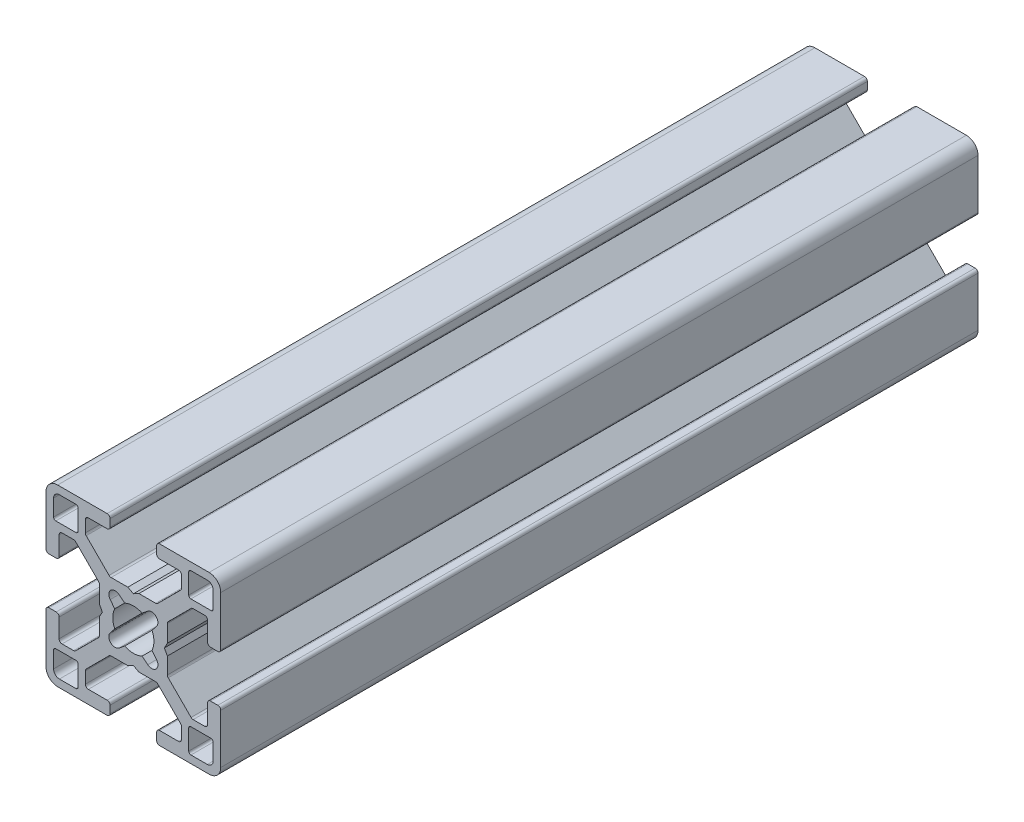
from build123d import *

# Parameters (mm, degrees)
EXTRUDE1_DEPTH = 130


with BuildPart() as part:
    # Sketch1 → Extrude1 (new body)
    with BuildSketch(Plane.XY):
        with BuildLine():
            Line((12.74247465, -4.5), (12.74247465, -7.732519321))
            ThreePointArc((12.74247465, -7.732519321), (12.602449697, -8.097296796), (12.242781236, -8.249967))
            Line((12.242781236, -8.249967), (10.260188032, -8.249967))
            ThreePointArc((10.260188032, -8.249967), (10.068847082, -8.211906919), (9.906636056, -8.103520976))
            Line((9.906636056, -8.103520976), (5.981117769, -4.178002689))
            ThreePointArc((5.981117769, -4.178002689), (5.872731827, -4.015791664), (5.834671745, -3.824450713))
            Line((5.834671745, -3.824450713), (5.834671745, -1.01249595))
            Line((5.834671745, -1.01249595), (5.324673785, -0.06249975))
            Line((5.324673785, -0.06249975), (5.834671745, 0.88749645))
            Line((5.834671745, 0.88749645), (5.834671745, 3.824450713))
            ThreePointArc((5.834671745, 3.824450713), (5.872731827, 4.015791664), (5.981117769, 4.178002689))
            Line((5.981117769, 4.178002689), (9.906636056, 8.103520976))
            ThreePointArc((9.906636056, 8.103520976), (10.068847082, 8.211906919), (10.260188032, 8.249967))
            Line((10.260188032, 8.249967), (12.242781236, 8.249967))
            ThreePointArc((12.242781236, 8.249967), (12.602449697, 8.097296796), (12.74247465, 7.732519321))
            Line((12.74247465, 7.732519321), (12.74247465, 4.5))
            ThreePointArc((12.74247465, 4.5), (12.88892126, 4.146446609), (13.24247465, 4))
            Line((13.24247465, 4), (14.49994, 4))
            ThreePointArc((14.49994, 4), (14.853493391, 4.146446609), (14.99994, 4.5))
            Line((14.99994, 4.5), (14.99994, 12.999948))
            ThreePointArc((14.99994, 12.999948), (14.414155906, 14.414155906), (12.999948, 14.99994))
            Line((12.999948, 14.99994), (4.5, 14.99994))
            ThreePointArc((4.5, 14.99994), (4.146446609, 14.853493391), (4, 14.49994))
            Line((4, 14.49994), (4, 13.24247465))
            ThreePointArc((4, 13.24247465), (4.146446609, 12.88892126), (4.5, 12.74247465))
            Line((4.5, 12.74247465), (7.732519321, 12.74247465))
            ThreePointArc((7.732519321, 12.74247465), (8.097296796, 12.602449697), (8.249967, 12.242781236))
            Line((8.249967, 12.242781236), (8.249967, 10.260188032))
            ThreePointArc((8.249967, 10.260188032), (8.211906919, 10.068847082), (8.103520976, 9.906636056))
            Line((8.103520976, 9.906636056), (4.178002689, 5.981117769))
            ThreePointArc((4.178002689, 5.981117769), (4.015791664, 5.872731827), (3.824450713, 5.834671745))
            Line((3.824450713, 5.834671745), (0.9499962, 5.834671745))
            Line((0.9499962, 5.834671745), (0, 5.324673785))
            Line((0, 5.324673785), (-0.9499962, 5.834671745))
            Line((-0.9499962, 5.834671745), (-3.824450713, 5.834671745))
            ThreePointArc((-3.824450713, 5.834671745), (-4.015791664, 5.872731827), (-4.178002689, 5.981117769))
            Line((-4.178002689, 5.981117769), (-8.103520976, 9.906636056))
            ThreePointArc((-8.103520976, 9.906636056), (-8.211906919, 10.068847082), (-8.249967, 10.260188032))
            Line((-8.249967, 10.260188032), (-8.249967, 12.242781236))
            ThreePointArc((-8.249967, 12.242781236), (-8.097296796, 12.602449697), (-7.732519321, 12.74247465))
            Line((-7.732519321, 12.74247465), (-4.5, 12.74247465))
            ThreePointArc((-4.5, 12.74247465), (-4.146446609, 12.88892126), (-4, 13.24247465))
            Line((-4, 13.24247465), (-4, 14.49994))
            ThreePointArc((-4, 14.49994), (-4.146446609, 14.853493391), (-4.5, 14.99994))
            Line((-4.5, 14.99994), (-12.999948, 14.99994))
            ThreePointArc((-12.999948, 14.99994), (-14.414155906, 14.414155906), (-14.99994, 12.999948))
            Line((-14.99994, 12.999948), (-14.99994, 4.5))
            ThreePointArc((-14.99994, 4.5), (-14.853493391, 4.146446609), (-14.49994, 4))
            Line((-14.49994, 4), (-13.24247465, 4))
            ThreePointArc((-13.24247465, 4), (-12.88892126, 4.146446609), (-12.74247465, 4.5))
            Line((-12.74247465, 4.5), (-12.74247465, 7.732519321))
            ThreePointArc((-12.74247465, 7.732519321), (-12.602449697, 8.097296796), (-12.242781236, 8.249967))
            Line((-12.242781236, 8.249967), (-10.260188032, 8.249967))
            ThreePointArc((-10.260188032, 8.249967), (-10.068847082, 8.211906919), (-9.906636056, 8.103520976))
            Line((-9.906636056, 8.103520976), (-5.981117769, 4.178002689))
            ThreePointArc((-5.981117769, 4.178002689), (-5.872731827, 4.015791664), (-5.834671745, 3.824450713))
            Line((-5.834671745, 3.824450713), (-5.834671745, 0.88749645))
            Line((-5.834671745, 0.88749645), (-5.324673785, -0.06249975))
            Line((-5.324673785, -0.06249975), (-5.834671745, -1.01249595))
            Line((-5.834671745, -1.01249595), (-5.834671745, -3.824450713))
            ThreePointArc((-5.834671745, -3.824450713), (-5.872731827, -4.015791664), (-5.981117769, -4.178002689))
            Line((-5.981117769, -4.178002689), (-9.906636056, -8.103520976))
            ThreePointArc((-9.906636056, -8.103520976), (-10.068847082, -8.211906919), (-10.260188032, -8.249967))
            Line((-10.260188032, -8.249967), (-12.242781236, -8.249967))
            ThreePointArc((-12.242781236, -8.249967), (-12.602449697, -8.097296796), (-12.74247465, -7.732519321))
            Line((-12.74247465, -7.732519321), (-12.74247465, -4.5))
            ThreePointArc((-12.74247465, -4.5), (-12.88892126, -4.146446609), (-13.24247465, -4))
            Line((-13.24247465, -4), (-14.49994, -4))
            ThreePointArc((-14.49994, -4), (-14.853493391, -4.146446609), (-14.99994, -4.5))
            Line((-14.99994, -4.5), (-14.99994, -12.999948))
            ThreePointArc((-14.99994, -12.999948), (-14.414155906, -14.414155906), (-12.999948, -14.99994))
            Line((-12.999948, -14.99994), (-4.5, -14.99994))
            ThreePointArc((-4.5, -14.99994), (-4.146446609, -14.853493391), (-4, -14.49994))
            Line((-4, -14.49994), (-4, -13.24247465))
            ThreePointArc((-4, -13.24247465), (-4.146446609, -12.88892126), (-4.5, -12.74247465))
            Line((-4.5, -12.74247465), (-7.732519321, -12.74247465))
            ThreePointArc((-7.732519321, -12.74247465), (-8.097296796, -12.602449697), (-8.249967, -12.242781236))
            Line((-8.249967, -12.242781236), (-8.249967, -10.260188032))
            ThreePointArc((-8.249967, -10.260188032), (-8.211906919, -10.068847082), (-8.103520976, -9.906636056))
            Line((-8.103520976, -9.906636056), (-4.178002689, -5.981117769))
            ThreePointArc((-4.178002689, -5.981117769), (-4.015791664, -5.872731827), (-3.824450713, -5.834671745))
            Line((-3.824450713, -5.834671745), (-0.9499962, -5.834671745))
            Line((-0.9499962, -5.834671745), (0, -5.324673785))
            Line((0, -5.324673785), (0.9499962, -5.834671745))
            Line((0.9499962, -5.834671745), (3.824450713, -5.834671745))
            ThreePointArc((3.824450713, -5.834671745), (4.015791664, -5.872731827), (4.178002689, -5.981117769))
            Line((4.178002689, -5.981117769), (8.103520976, -9.906636056))
            ThreePointArc((8.103520976, -9.906636056), (8.211906919, -10.068847082), (8.249967, -10.260188032))
            Line((8.249967, -10.260188032), (8.249967, -12.242781236))
            ThreePointArc((8.249967, -12.242781236), (8.097296796, -12.602449697), (7.732519321, -12.74247465))
            Line((7.732519321, -12.74247465), (4.5, -12.74247465))
            ThreePointArc((4.5, -12.74247465), (4.146446609, -12.88892126), (4, -13.24247465))
            Line((4, -13.24247465), (4, -14.49994))
            ThreePointArc((4, -14.49994), (4.146446609, -14.853493391), (4.5, -14.99994))
            Line((4.5, -14.99994), (12.999948, -14.99994))
            ThreePointArc((12.999948, -14.99994), (14.414155906, -14.414155906), (14.99994, -12.999948))
            Line((14.99994, -12.999948), (14.99994, -4.5))
            ThreePointArc((14.99994, -4.5), (14.853493391, -4.146446609), (14.49994, -4))
            Line((14.49994, -4), (13.24247465, -4))
            ThreePointArc((13.24247465, -4), (12.88892126, -4.146446609), (12.74247465, -4.5))
        make_face()
        with BuildLine():
            Line((9.499962, -13.318946724), (9.499962, -9.87996048))
            ThreePointArc((9.499962, -9.87996048), (9.611260978, -9.611260978), (9.87996048, -9.499962))
            Line((9.87996048, -9.499962), (13.318946724, -9.499962))
            ThreePointArc((13.318946724, -9.499962), (13.58835333, -9.61155387), (13.6999452, -9.880960476))
            Line((13.6999452, -9.880960476), (13.6999452, -12.6999492))
            ThreePointArc((13.6999452, -12.6999492), (13.407053153, -13.407053153), (12.6999492, -13.6999452))
            Line((12.6999492, -13.6999452), (9.880960476, -13.6999452))
            ThreePointArc((9.880960476, -13.6999452), (9.61155387, -13.58835333), (9.499962, -13.318946724))
        make_face(mode=Mode.SUBTRACT)
        with BuildLine():
            Line((-13.318946724, -9.499962), (-9.87996048, -9.499962))
            ThreePointArc((-9.87996048, -9.499962), (-9.611260978, -9.611260978), (-9.499962, -9.87996048))
            Line((-9.499962, -9.87996048), (-9.499962, -13.318946724))
            ThreePointArc((-9.499962, -13.318946724), (-9.61155387, -13.58835333), (-9.880960476, -13.6999452))
            Line((-9.880960476, -13.6999452), (-12.6999492, -13.6999452))
            ThreePointArc((-12.6999492, -13.6999452), (-13.407053153, -13.407053153), (-13.6999452, -12.6999492))
            Line((-13.6999452, -12.6999492), (-13.6999452, -9.880960476))
            ThreePointArc((-13.6999452, -9.880960476), (-13.58835333, -9.61155387), (-13.318946724, -9.499962))
        make_face(mode=Mode.SUBTRACT)
        with BuildLine():
            Line((-1.494225248, -3.198138712), (-2.473341823, -3.979927146))
            ThreePointArc((-2.473341823, -3.979927146), (-3.900227701, -3.900227701), (-3.979927146, -2.473341823))
            Line((-3.979927146, -2.473341823), (-3.198138712, -1.494225248))
            ThreePointArc((-3.198138712, -1.494225248), (-3.52998588, 0), (-3.198138712, 1.494225248))
            Line((-3.198138712, 1.494225248), (-3.979927146, 2.473341823))
            ThreePointArc((-3.979927146, 2.473341823), (-3.900227701, 3.900227701), (-2.473341823, 3.979927146))
            Line((-2.473341823, 3.979927146), (-1.494225248, 3.198138712))
            ThreePointArc((-1.494225248, 3.198138712), (0, 3.52998588), (1.494225248, 3.198138712))
            Line((1.494225248, 3.198138712), (2.473341823, 3.979927146))
            ThreePointArc((2.473341823, 3.979927146), (3.900227701, 3.900227701), (3.979927146, 2.473341823))
            Line((3.979927146, 2.473341823), (3.198138712, 1.494225248))
            ThreePointArc((3.198138712, 1.494225248), (3.52998588, 0), (3.198138712, -1.494225248))
            Line((3.198138712, -1.494225248), (3.979927146, -2.473341823))
            ThreePointArc((3.979927146, -2.473341823), (3.900227701, -3.900227701), (2.473341823, -3.979927146))
            Line((2.473341823, -3.979927146), (1.494225248, -3.198138712))
            ThreePointArc((1.494225248, -3.198138712), (0, -3.52998588), (-1.494225248, -3.198138712))
        make_face(mode=Mode.SUBTRACT)
        with BuildLine():
            Line((-9.499962, 13.318946724), (-9.499962, 9.87996048))
            ThreePointArc((-9.499962, 9.87996048), (-9.611260978, 9.611260978), (-9.87996048, 9.499962))
            Line((-9.87996048, 9.499962), (-13.318946724, 9.499962))
            ThreePointArc((-13.318946724, 9.499962), (-13.58835333, 9.61155387), (-13.6999452, 9.880960476))
            Line((-13.6999452, 9.880960476), (-13.6999452, 12.6999492))
            ThreePointArc((-13.6999452, 12.6999492), (-13.407053153, 13.407053153), (-12.6999492, 13.6999452))
            Line((-12.6999492, 13.6999452), (-9.880960476, 13.6999452))
            ThreePointArc((-9.880960476, 13.6999452), (-9.61155387, 13.58835333), (-9.499962, 13.318946724))
        make_face(mode=Mode.SUBTRACT)
        with BuildLine():
            Line((9.880960476, 13.6999452), (12.6999492, 13.6999452))
            ThreePointArc((12.6999492, 13.6999452), (13.407053153, 13.407053153), (13.6999452, 12.6999492))
            Line((13.6999452, 12.6999492), (13.6999452, 9.880960476))
            ThreePointArc((13.6999452, 9.880960476), (13.58835333, 9.61155387), (13.318946724, 9.499962))
            Line((13.318946724, 9.499962), (9.87996048, 9.499962))
            ThreePointArc((9.87996048, 9.499962), (9.611260978, 9.611260978), (9.499962, 9.87996048))
            Line((9.499962, 9.87996048), (9.499962, 13.318946724))
            ThreePointArc((9.499962, 13.318946724), (9.61155387, 13.58835333), (9.880960476, 13.6999452))
        make_face(mode=Mode.SUBTRACT)
    extrude(amount=-EXTRUDE1_DEPTH)


solid = part.part
